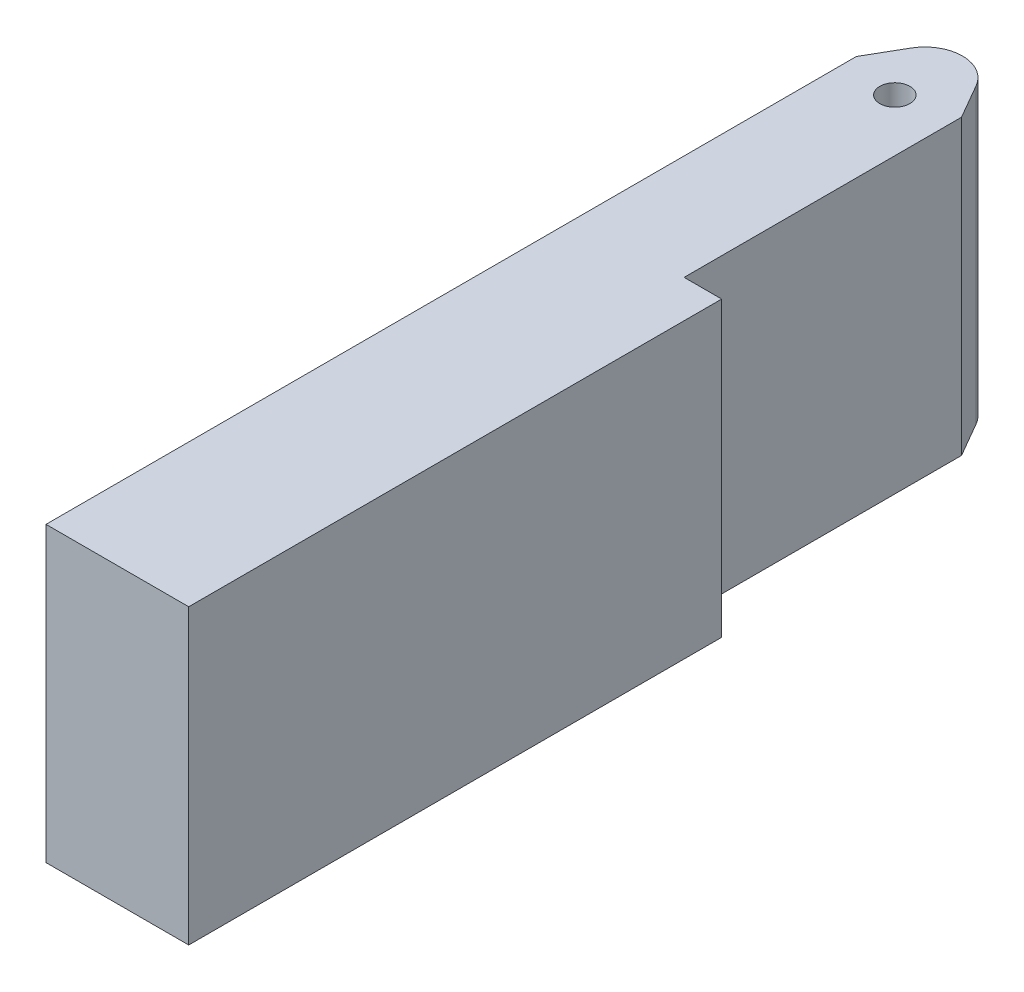
from build123d import *

# Parameters (mm, degrees)
SKETCH1_W           = 22
SKETCH1_H           = 120
BOSS_EXTRUDE1_DEPTH = 39
SKETCH2_OUTSIDE_W   = 49.616
SKETCH2_OUTSIDE_H   = 147.616
CUT_EXTRUDE1_DEPTH  = 73.40165744
FILLET1_R           = 5
CUT_EXTRUDE2_DEPTH  = 73.40165744
SKETCH4_W           = 96.947441117
SKETCH4_H           = 39
BOSS_EXTRUDE2_DEPTH = 5
SKETCH5_W           = 4
SKETCH5_H           = 96.947441117
CUT_EXTRUDE3_DEPTH  = 74.328030111
SKETCH6_W           = 4
SKETCH6_H           = 96.947441117
CUT_EXTRUDE4_DEPTH  = 74.328030111
SKETCH7_R           = 2
CUT_EXTRUDE5_DEPTH  = 73.560319735
SKETCH8_W           = 5
SKETCH8_H           = 26
CUT_EXTRUDE6_DEPTH  = 73.560319735


with BuildPart() as part:
    # Sketch1 → Boss-Extrude1 (new body)
    with BuildSketch(Plane(origin=(0, 0, 0), x_dir=(1, 0, 0), z_dir=(0, 1, 0))):
        Rectangle(SKETCH1_W, SKETCH1_H)
    extrude(amount=BOSS_EXTRUDE1_DEPTH)

    # Sketch2 outside → Cut-Extrude1 (cut, through all)
    with BuildSketch(Plane(origin=(0, 39, 0), x_dir=(1, 0, 0), z_dir=(0, 1, 0))):
        Rectangle(SKETCH2_OUTSIDE_W, SKETCH2_OUTSIDE_H)
        Polygon((0, 60), (-11, 40.947441117), (-11, -60), (11, -60), (11, 40.947441117), align=None, mode=Mode.SUBTRACT)
    extrude(amount=-CUT_EXTRUDE1_DEPTH, mode=Mode.SUBTRACT)

    # Fillet1
    fillet1_edges = [part.edges().sort_by_distance(p)[0] for p in [
        (0, 19.5, -60),
    ]]
    fillet(fillet1_edges, radius=FILLET1_R)

    # Sketch3 → Cut-Extrude2 (cut, through all)
    with BuildSketch(Plane(origin=(0, 39, 0), x_dir=(1, 0, 0), z_dir=(0, 1, 0))):
        Polygon((-11, 36.947441117), (-7, 36.947441117), (-7, 47.875644347), (-11, 40.947441117), align=None)
        Polygon((7, 47.875644347), (11, 40.947441117), (11, 36.947441117), (7, 36.947441117), align=None)
    extrude(amount=-CUT_EXTRUDE2_DEPTH, mode=Mode.SUBTRACT)

    # Sketch4 → Boss-Extrude2 (add)
    with BuildSketch(Plane(origin=(11, 0, 0), x_dir=(0, 0, -1), z_dir=(1, 0, 0))):
        with Locations((-11.526279442, 19.5)):
            Rectangle(SKETCH4_W, SKETCH4_H)
    extrude(amount=BOSS_EXTRUDE2_DEPTH)

    # Sketch5 → Cut-Extrude3 (cut, through all)
    with BuildSketch(Plane(origin=(0, 39, 0), x_dir=(1, 0, 0), z_dir=(0, 1, 0))):
        with Locations((-9, -11.526279442)):
            Rectangle(SKETCH5_W, SKETCH5_H)
    extrude(amount=-CUT_EXTRUDE3_DEPTH, mode=Mode.SUBTRACT)

    # Sketch6 → Cut-Extrude4 (cut, through all)
    with BuildSketch(Plane(origin=(0, 39, 0), x_dir=(1, 0, 0), z_dir=(0, 1, 0))):
        with Locations((14, -11.526279442)):
            Rectangle(SKETCH6_W, SKETCH6_H)
    extrude(amount=-CUT_EXTRUDE4_DEPTH, mode=Mode.SUBTRACT)

    # Sketch7 → Cut-Extrude5 (cut, through all)
    with BuildSketch(Plane(origin=(0, 39, 0), x_dir=(1, 0, 0), z_dir=(0, 1, 0))):
        with Locations((0, 46)):
            Circle(SKETCH7_R)
    extrude(amount=-CUT_EXTRUDE5_DEPTH, mode=Mode.SUBTRACT)

    # Sketch8 → Cut-Extrude6 (cut, through all)
    with BuildSketch(Plane(origin=(0, 39, 0), x_dir=(1, 0, 0), z_dir=(0, 1, 0))):
        with Locations((9.5, 23.947441117)):
            Rectangle(SKETCH8_W, SKETCH8_H)
    extrude(amount=-CUT_EXTRUDE6_DEPTH, mode=Mode.SUBTRACT)


solid = part.part
